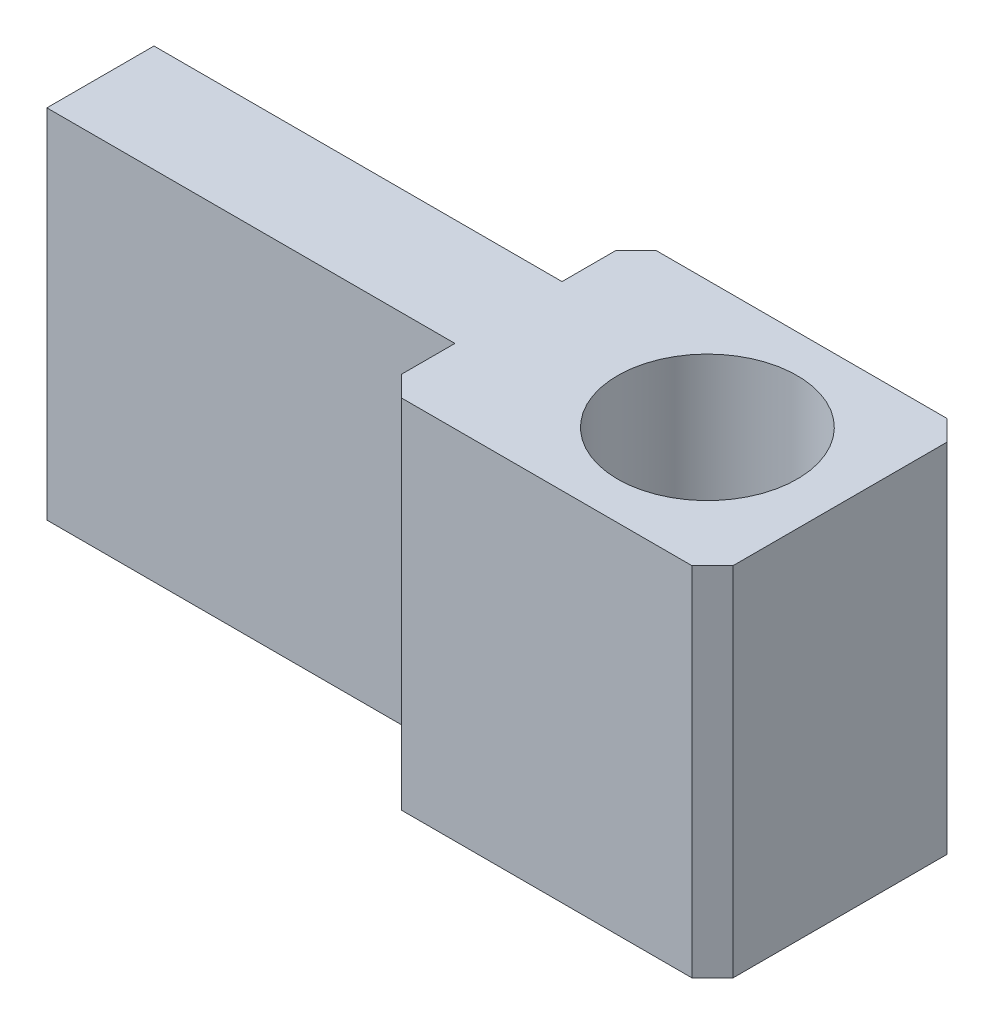
from build123d import *

# Parameters (mm, degrees)
SKETCH1_W           = 50.8
SKETCH1_H           = 6.6675
BOSS_EXTRUDE1_DEPTH = 44.45
CHAMFER1_SIZE       = 2.54
CHAMFER2_SIZE       = 2.54
SKETCH2_R           = 11.176
CUT_EXTRUDE1_DEPTH  = 44.45


with BuildPart() as part:
    # Sketch1 → Boss-Extrude1 (new body)
    with BuildSketch(Plane(origin=(0, 0, 0), x_dir=(1, 0, 0), z_dir=(0, 1, 0))):
        Polygon((0, 22.5425), (0, 15.875), (0, 9.2075), (0, 0), (41.275, 0), (41.275, 31.75), (0, 31.75), align=None)
        with Locations((-25.4, 19.20875)):
            Rectangle(SKETCH1_W, SKETCH1_H)
        with Locations((-25.4, 12.54125)):
            Rectangle(SKETCH1_W, SKETCH1_H)
    extrude(amount=BOSS_EXTRUDE1_DEPTH)

    # Chamfer1
    chamfer1_edges = [part.edges().sort_by_distance(p)[0] for p in [
        (0, 22.225, 0),
        (41.275, 22.225, -31.75),
        (41.275, 22.225, 0),
    ]]
    chamfer(chamfer1_edges, length=CHAMFER1_SIZE)

    # Chamfer2
    chamfer2_edges = [part.edges().sort_by_distance(p)[0] for p in [
        (0, 22.225, -31.75),
    ]]
    chamfer(chamfer2_edges, length=CHAMFER2_SIZE)

    # Sketch2 → Cut-Extrude1 (cut)
    with BuildSketch(Plane(origin=(0, 44.45, 0), x_dir=(1, 0, 0), z_dir=(0, 1, 0))):
        with Locations(Location((24.765, 15.875, 0), (0, 0, 270))):
            Circle(SKETCH2_R)
    extrude(amount=-CUT_EXTRUDE1_DEPTH, mode=Mode.SUBTRACT)


solid = part.part
